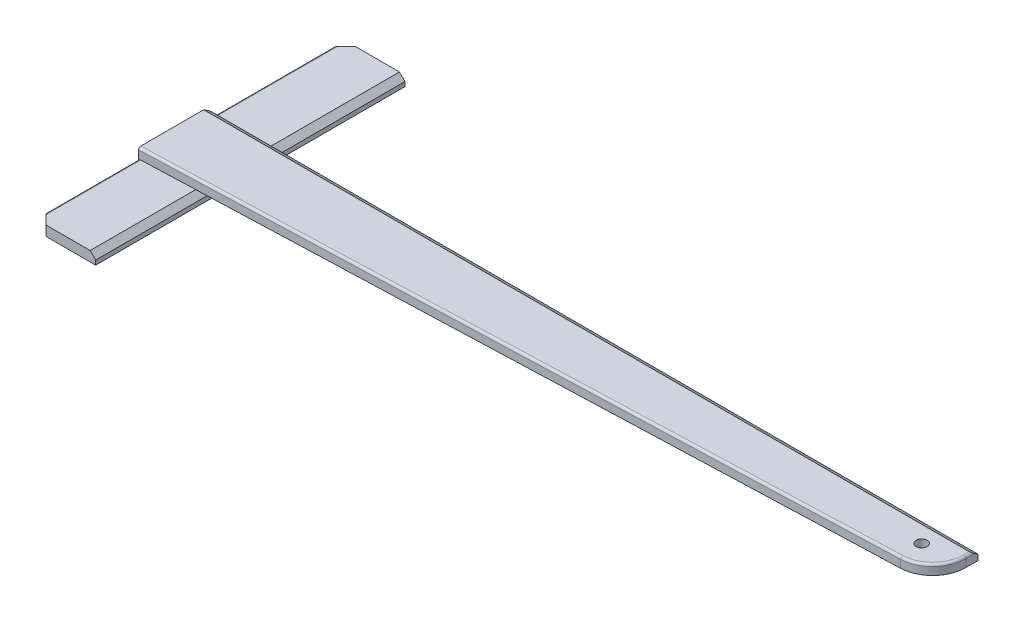
from build123d import *

# Parameters (mm, degrees)
SKETCH1_W           = 1397
SKETCH1_H           = 7112
BOSS_EXTRUDE1_DEPTH = 228.6
CHAMFER1_SIZE       = 127
CHAMFER3_SIZE       = 254
CHAMFER4_SIZE       = 254
BOSS_EXTRUDE2_DEPTH = 228.6
CHAMFER5_SIZE       = 101.6
CHAMFER5_SIZE2      = 152.4
FILLET1_R           = 762
FILLET2_R           = 50.8
SKETCH4_R           = 127
CUT_EXTRUDE1_DEPTH  = 19038.278819294


with BuildPart() as part:
    # Sketch1 → Boss-Extrude1 (new body)
    with BuildSketch(Plane(origin=(0, 0, 0), x_dir=(1, 0, 0), z_dir=(0, 1, 0))):
        with Locations((698.5, 3556)):
            Rectangle(SKETCH1_W, SKETCH1_H)
    extrude(amount=BOSS_EXTRUDE1_DEPTH)

    # Chamfer1
    chamfer1_edges = [part.edges().sort_by_distance(p)[0] for p in [
        (1397, 228.6, -3556),
    ]]
    chamfer(chamfer1_edges, length=CHAMFER1_SIZE)

    # Chamfer3
    chamfer3_edges = [part.edges().sort_by_distance(p)[0] for p in [
        (0, 114.3, -7112),
    ]]
    chamfer(chamfer3_edges, length=CHAMFER3_SIZE)

    # Chamfer4
    chamfer4_edges = [part.edges().sort_by_distance(p)[0] for p in [
        (0, 114.3, 0),
    ]]
    chamfer(chamfer4_edges, length=CHAMFER4_SIZE)

    # Sketch3 → Boss-Extrude2 (add)
    with BuildSketch(Plane(origin=(0, 228.6, 0), x_dir=(1, 0, 0), z_dir=(0, 1, 0))):
        Polygon((17653, 3016.28768746), (0, 2381.28768746), (0, 4032.28768746), (17653, 4032.28768746), align=None)
    extrude(amount=BOSS_EXTRUDE2_DEPTH)

    # Chamfer5
    chamfer5_edges = [part.edges().sort_by_distance(p)[0] for p in [
        (8826.5, 457.2, -4032.28768746),
    ]]
    chamfer5_side = [part.faces().sort_by_distance(p)[0] for p in [
        (8826.5, 342.9, -4032.28768746),
    ]]
    chamfer(chamfer5_edges, length=CHAMFER5_SIZE, length2=CHAMFER5_SIZE2, reference=chamfer5_side[0])

    # Fillet1
    fillet1_edges = [part.edges().sort_by_distance(p)[0] for p in [
        (17653, 342.9, -3016.28768746),
    ]]
    fillet(fillet1_edges, radius=FILLET1_R)

    # Fillet2
    fillet2_edges = [part.edges().sort_by_distance(p)[0] for p in [
        (0, 228.6, -5445.14384373),
        (0, 228.6, -1317.64384373),
        (8459.196177896, 457.2, -2685.575319758),
        (17653, 457.2, -3815.629065257),
        (17439.41452165, 457.2, -3222.328372473),
    ]]
    fillet(fillet2_edges, radius=FILLET2_R)

    # Sketch4 → Cut-Extrude1 (cut, through all)
    with BuildSketch(Plane(origin=(0, 457.2, 0), x_dir=(1, 0, 0), z_dir=(0, 1, 0))):
        with Locations(Location((16891, 3497.862952057, 0), (0, 0, 270))):
            Circle(SKETCH4_R)
    extrude(amount=-CUT_EXTRUDE1_DEPTH, mode=Mode.SUBTRACT)


solid = part.part
